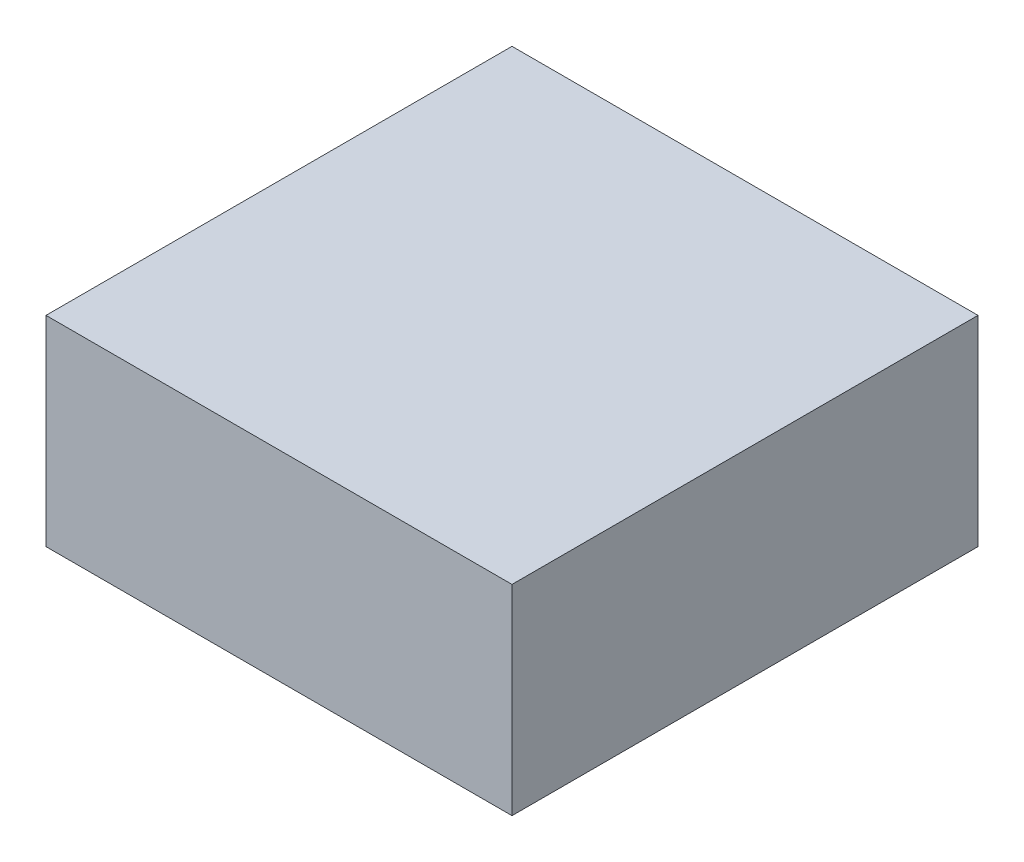
from build123d import *

# Parameters (mm, degrees)
SKETCH1_W           = 57.912
SKETCH1_H           = 57.912
BOSS_EXTRUDE1_DEPTH = 24.892


with BuildPart() as part:
    # Sketch1 → Boss-Extrude1 (new body)
    with BuildSketch(Plane(origin=(0, 0, 0), x_dir=(1, 0, 0), z_dir=(0, 1, 0))):
        with Locations((28.956, 28.956)):
            Rectangle(SKETCH1_W, SKETCH1_H)
    extrude(amount=BOSS_EXTRUDE1_DEPTH)


solid = part.part
